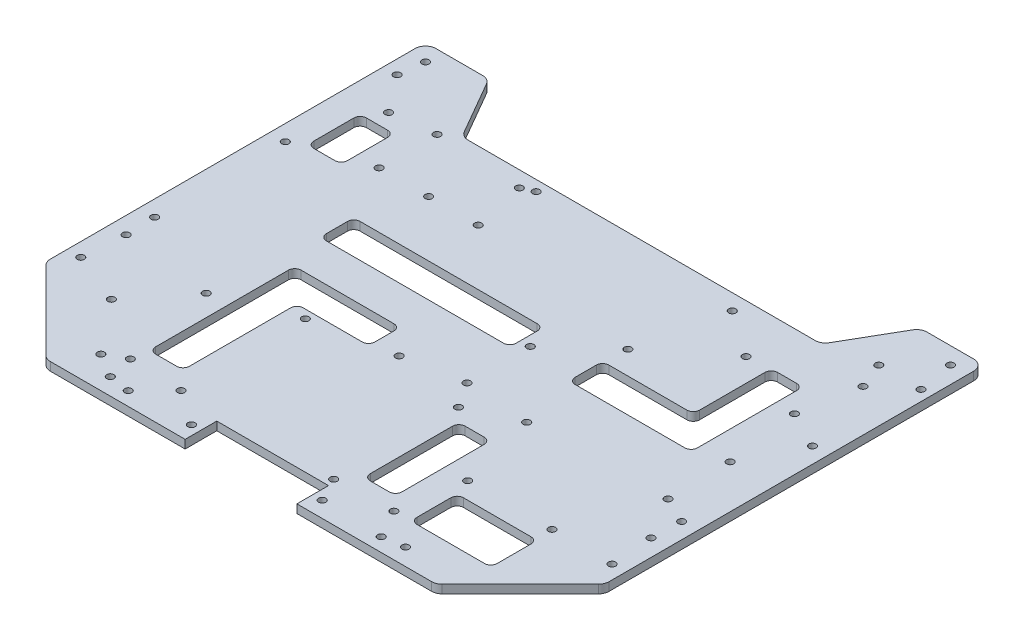
from build123d import *

# Parameters (mm, degrees)
MAIN_EXTRUSION_DEPTH    = 4
CONG_1_R                = 5
ESQUISSE1_R             = 1
ENL_V_MAT_EXTRU_1_DEPTH = 257.850637531
D_GAGEMENT_M31_D        = 3.4
ESQUISSE4_R             = 1
ESQUISSE4_R_2           = 1.5
ESQUISSE4_W             = 53
ESQUISSE4_H             = 15
ENL_V_MAT_EXTRU_2_DEPTH = 257.850637531
D_GAGEMENT_M32_D        = 3.4
ESQUISSE7_W             = 90
ESQUISSE7_H             = 16
ESQUISSE7_W_2           = 38
ESQUISSE7_H_2           = 22
ESQUISSE7_W_3           = 16
ESQUISSE7_H_3           = 25
ESQUISSE7_W_4           = 15
ESQUISSE7_H_4           = 45
ENL_V_MAT_EXTRU_3_DEPTH = 4
CONG_2_R                = 3


with BuildPart() as part:
    # Main scetch → Main extrusion (new body)
    with BuildSketch(Plane(origin=(0, 0, 0), x_dir=(1, 0, 0), z_dir=(0, 1, 0))):
        Polygon((-92.5, 0), (92.5, 0), (132.5, 40), (132.5, 220), (102.5, 220), (85.179491924, 190), (-85.179491924, 190), (-102.5, 220), (-132.5, 220), (-132.5, 40), align=None)
    extrude(amount=MAIN_EXTRUSION_DEPTH)

    # Congé1
    cong_1_edges = [part.edges().sort_by_distance(p)[0] for p in [
        (132.5, 2, -220),
        (132.5, 2, -40),
        (92.5, 2, 0),
        (-92.5, 2, 0),
        (-132.5, 2, -40),
        (-132.5, 2, -220),
        (-102.5, 2, -220),
        (-85.179491924, 2, -190),
        (85.179491924, 2, -190),
        (102.5, 2, -220),
    ]]
    fillet(cong_1_edges, radius=CONG_1_R)

    # Esquisse1 → Enlèv. mat.-Extru.1 (cut, through all)
    with BuildSketch(Plane(origin=(0, 4, 0), x_dir=(1, 0, 0), z_dir=(0, 1, 0))):
        with Locations(Location((70, 8, 0), (0, 0, 270))):
            Circle(ESQUISSE1_R)
        with Locations(Location((124.5, 70, 0), (0, 0, 270))):
            Circle(ESQUISSE1_R)
        with Locations(Location((124.5, 212, 0), (0, 0, 270))):
            Circle(ESQUISSE1_R)
        with Locations(Location((-124.5, 212, 0), (0, 0, 90))):
            Circle(ESQUISSE1_R)
        with Locations(Location((-124.5, 70, 0), (0, 0, 90))):
            Circle(ESQUISSE1_R)
        with Locations(Location((-70, 8, 0), (0, 0, 90))):
            Circle(ESQUISSE1_R)
    extrude(amount=-ENL_V_MAT_EXTRU_1_DEPTH, mode=Mode.SUBTRACT)

    # Dégagement M31 (through all)
    with Locations(Plane(origin=(0, 4, 0), x_dir=(1, 0, 0), z_dir=(0, 1, 0))):
        with Locations((-124.5, 212), (-124.5, 70), (-70, 8), (70, 8), (124.5, 70), (124.5, 212)):
            Hole(D_GAGEMENT_M31_D / 2)

    # Esquisse4 → Enlèv. mat.-Extru.2 (cut, through all)
    with BuildSketch(Plane(origin=(0, 4, 0), x_dir=(1, 0, 0), z_dir=(0, 1, 0))):
        with Locations(Location((72.5, 167, 0), (0, 0, 270))):
            Circle(ESQUISSE4_R)
        with Locations(Location((41.5, 142, 0), (0, 0, 270))):
            Circle(ESQUISSE4_R)
        with Locations(Location((107.5, 155, 0), (0, 0, 270))):
            Circle(ESQUISSE4_R)
        with Locations(Location((127.5, 195, 0), (0, 0, 270))):
            Circle(ESQUISSE4_R)
        with Locations(Location((112, 120, 0), (0, 0, 270))):
            Circle(ESQUISSE4_R)
        with Locations(Location((112.5, 90, 0), (0, 0, 270))):
            Circle(ESQUISSE4_R)
        with Locations(Location((17.2, 120, 0), (0, 0, 270))):
            Circle(ESQUISSE4_R)
        with Locations(Location((17.2, 90, 0), (0, 0, 270))):
            Circle(ESQUISSE4_R)
        with Locations(Location((47.5, 88, 0), (0, 0, 270))):
            Circle(ESQUISSE4_R)
        with Locations(Location((57.5, 50, 0), (0, 0, 270))):
            Circle(ESQUISSE4_R)
        with Locations(Location((97.5, 50, 0), (0, 0, 270))):
            Circle(ESQUISSE4_R)
        with Locations(Location((52.5, 20, 0), (0, 0, 270))):
            Circle(ESQUISSE4_R)
        with Locations(Location((-10, 85, 0), (0, 0, 270))):
            Circle(ESQUISSE4_R)
        with Locations(Location((-72.5, 20, 0), (0, 0, 270))):
            Circle(ESQUISSE4_R)
        with Locations(Location((107.5, 195, 0), (0, 0, 270))):
            Circle(ESQUISSE4_R)
        with Locations(Location((-47.5, 78, 0), (0, 0, 270))):
            Circle(ESQUISSE4_R)
        with Locations(Location((25.14, 78, 0), (0, 0, 270))):
            Circle(ESQUISSE4_R)
        with Locations(Location((-47.5, 19.07, 0), (0, 0, 270))):
            Circle(ESQUISSE4_R)
        with Locations(Location((25.109569617, 18.82, 0), (0, 0, 270))):
            Circle(ESQUISSE4_R)
        with Locations(Location((-125, 146, 0), (0, 0, 270))):
            Circle(ESQUISSE4_R)
        with Locations(Location((-125, 84, 0), (0, 0, 270))):
            Circle(ESQUISSE4_R)
        with Locations(Location((-31, 7.5, 0), (0, 0, 270))):
            Circle(ESQUISSE4_R)
        with Locations(Location((31, 7.5, 0), (0, 0, 270))):
            Circle(ESQUISSE4_R)
        with Locations(Location((125, 146, 0), (0, 0, 270))):
            Circle(ESQUISSE4_R)
        with Locations(Location((125, 84, 0), (0, 0, 270))):
            Circle(ESQUISSE4_R)
        with Locations(Location((50.5, 182.5, 0), (0, 0, 270))):
            Circle(ESQUISSE4_R)
        with Locations(Location((112.5, 182.5, 0), (0, 0, 270))):
            Circle(ESQUISSE4_R)
        with Locations(Location((-112.5, 182.5, 0), (0, 0, 270))):
            Circle(ESQUISSE4_R)
        with Locations(Location((-50.5, 182.5, 0), (0, 0, 270))):
            Circle(ESQUISSE4_R)
        with Locations(Location((-45, 185, 0), (0, 0, 270))):
            Circle(ESQUISSE4_R)
        with Locations(Location((-45, 157.5, 0), (0, 0, 270))):
            Circle(ESQUISSE4_R)
        with Locations(Location((-68.5, 157.5, 0), (0, 0, 270))):
            Circle(ESQUISSE4_R)
        with Locations(Location((-92, 157.5, 0), (0, 0, 270))):
            Circle(ESQUISSE4_R)
        with Locations(Location((-92, 185, 0), (0, 0, 270))):
            Circle(ESQUISSE4_R)
        with Locations(Location((126, 50, 0), (0, 0, 270))):
            Circle(ESQUISSE4_R_2)
        with Locations(Location((-60, 6.5, 0), (0, 0, 270))):
            Circle(ESQUISSE4_R_2)
        with Locations(Location((60, 6.5, 0), (0, 0, 270))):
            Circle(ESQUISSE4_R_2)
        with Locations(Location((-126, 50, 0), (0, 0, 270))):
            Circle(ESQUISSE4_R_2)
        with Locations(Location((-126, 200, 0), (0, 0, 270))):
            Circle(ESQUISSE4_R_2)
        with Locations(Location((-81.5, 65, 0), (0, 0, 270))):
            Circle(ESQUISSE4_R_2)
        with Locations(Location((-81.5, 15, 0), (0, 0, 270))):
            Circle(ESQUISSE4_R_2)
        with Locations(Location((-101.5, 40, 0), (0, 0, 270))):
            Circle(ESQUISSE4_R_2)
        with Locations((0, 7.5)):
            Rectangle(ESQUISSE4_W, ESQUISSE4_H)
    extrude(amount=-ENL_V_MAT_EXTRU_2_DEPTH, mode=Mode.SUBTRACT)

    # Dégagement M32 (through all)
    with Locations(Plane(origin=(0, 4, 0), x_dir=(1, 0, 0), z_dir=(0, 1, 0))):
        with Locations((17.2, 120), (41.5, 142), (72.5, 167), (107.5, 155), (127.5, 195), (112, 120), (112.5, 90), (47.5, 88), (17.2, 90), (57.5, 50), (97.5, 50), (-10, 85), (-72.5, 20), (52.5, 20), (107.5, 195), (-47.5, 78), (25.14, 78), (-47.5, 19.07), (25.109569617, 18.82), (-125, 146), (-125, 84), (-31, 7.5), (31, 7.5), (125, 146), (125, 84), (-112.5, 182.5), (-50.5, 182.5), (50.5, 182.5), (112.5, 182.5), (-92, 185), (-92, 157.5), (-68.5, 157.5), (-45, 157.5), (-45, 185), (126, 50), (-60, 6.5), (60, 6.5), (-126, 200), (-126, 50), (-81.5, 65), (-81.5, 15), (-101.5, 40)):
            Hole(D_GAGEMENT_M32_D / 2)

    # Esquisse7 → Enlèv. mat.-Extru.3 (cut)
    with BuildSketch(Plane(origin=(0, 4, 0), x_dir=(1, 0, 0), z_dir=(0, 1, 0))):
        with Locations((-32.5, 123)):
            Rectangle(ESQUISSE7_W, ESQUISSE7_H)
        Polygon((40.5, 115), (98.5, 115), (98.5, 168), (83.5, 168), (83.5, 131), (40.5, 131), align=None)
        with Locations((79.5, 31)):
            Rectangle(ESQUISSE7_W_2, ESQUISSE7_H_2)
        with Locations((-110.5, 162.5)):
            Rectangle(ESQUISSE7_W_3, ESQUISSE7_H_3)
        Polygon((-71.5, 28), (-55.5, 28), (-55.5, 82), (-21.5, 82), (-21.5, 97), (-71.5, 97), (-71.5, 83), align=None)
        with Locations((39, 49.32)):
            Rectangle(ESQUISSE7_W_4, ESQUISSE7_H_4)
    extrude(amount=-ENL_V_MAT_EXTRU_3_DEPTH, mode=Mode.SUBTRACT)

    # Congé2
    cong_2_edges = [part.edges().sort_by_distance(p)[0] for p in [
        (-102.5, 2, -150),
        (-102.5, 2, -175),
        (-118.5, 2, -175),
        (-118.5, 2, -150),
        (83.5, 2, -168),
        (83.5, 2, -131),
        (40.5, 2, -131),
        (40.5, 2, -115),
        (98.5, 2, -115),
        (98.5, 2, -168),
        (98.5, 2, -20),
        (98.5, 2, -42),
        (60.5, 2, -42),
        (60.5, 2, -20),
        (-55.5, 2, -28),
        (-55.5, 2, -82),
        (-21.5, 2, -82),
        (-21.5, 2, -97),
        (-71.5, 2, -97),
        (-71.5, 2, -28),
        (46.5, 2, -26.82),
        (46.5, 2, -71.82),
        (31.5, 2, -71.82),
        (31.5, 2, -26.82),
        (12.5, 2, -115),
        (12.5, 2, -131),
        (-77.5, 2, -131),
        (-77.5, 2, -115),
    ]]
    fillet(cong_2_edges, radius=CONG_2_R)


solid = part.part
